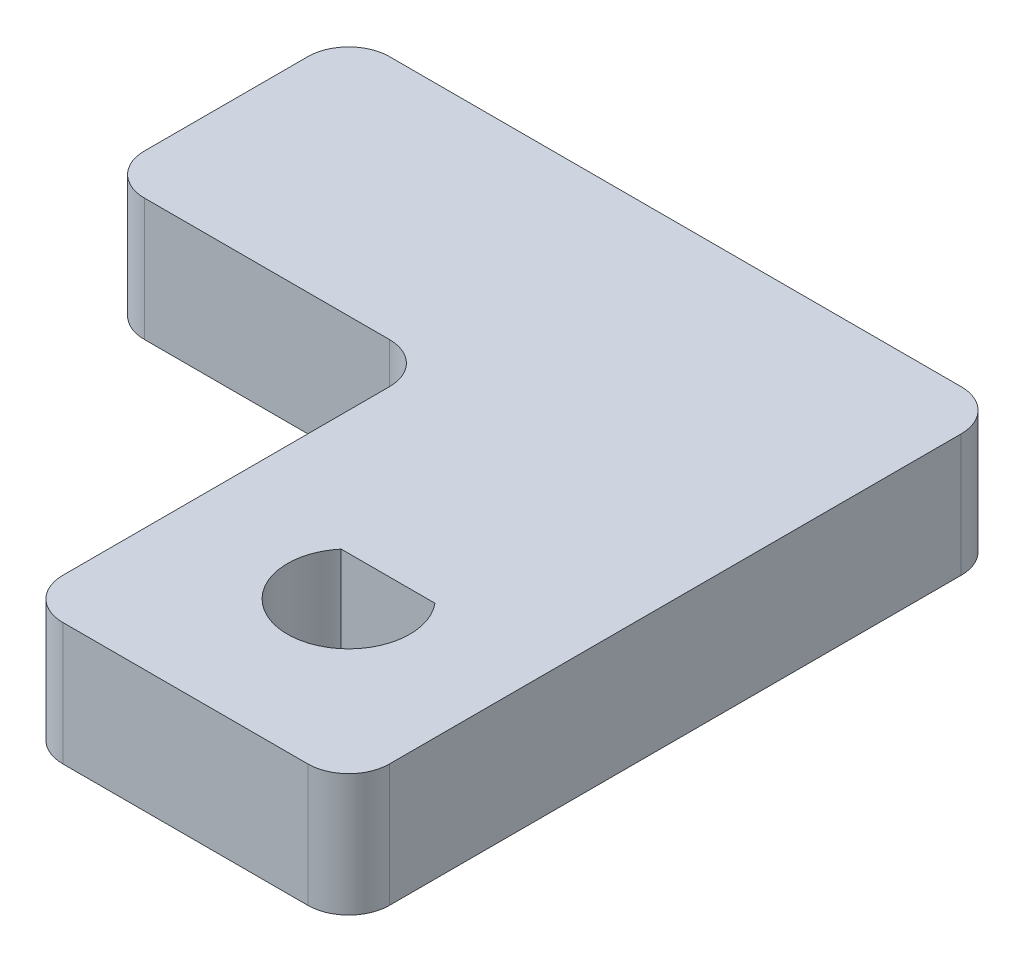
from build123d import *

# Parameters (mm, degrees)
BOSS_EXTRUDE2_DEPTH = 3
FILLET1_R           = 1
FILLET2_R           = 1
FILLET3_R           = 1
FILLET4_R           = 1
FILLET5_R           = 1
FILLET6_R           = 1
CUT_EXTRUDE2_DEPTH  = 3


with BuildPart() as part:
    # Sketch1 → Boss-Extrude2 (new body)
    with BuildSketch(Plane(origin=(0, 0, 0), x_dir=(1, 0, 0), z_dir=(0, 1, 0))):
        Polygon((-6.234693371, -2), (-14.234693371, -2), (-14.234693371, 8), (-22.234693371, 8), (-22.234693371, 14), (-6.234693371, 14), (-6.234693371, 8), align=None)
    extrude(amount=BOSS_EXTRUDE2_DEPTH)

    # Fillet1
    fillet1_edges = [part.edges().sort_by_distance(p)[0] for p in [
        (-22.234693371, 1.5, -14),
    ]]
    fillet(fillet1_edges, radius=FILLET1_R)

    # Fillet2
    fillet2_edges = [part.edges().sort_by_distance(p)[0] for p in [
        (-22.234693371, 1.5, -8),
    ]]
    fillet(fillet2_edges, radius=FILLET2_R)

    # Fillet3
    fillet3_edges = [part.edges().sort_by_distance(p)[0] for p in [
        (-6.234693371, 1.5, -14),
    ]]
    fillet(fillet3_edges, radius=FILLET3_R)

    # Fillet4
    fillet4_edges = [part.edges().sort_by_distance(p)[0] for p in [
        (-14.234693371, 1.5, 2),
    ]]
    fillet(fillet4_edges, radius=FILLET4_R)

    # Fillet5
    fillet5_edges = [part.edges().sort_by_distance(p)[0] for p in [
        (-6.234693371, 1.5, 2),
    ]]
    fillet(fillet5_edges, radius=FILLET5_R)

    # Fillet6
    fillet6_edges = [part.edges().sort_by_distance(p)[0] for p in [
        (-14.234693371, 1.5, -8),
    ]]
    fillet(fillet6_edges, radius=FILLET6_R)

    # Sketch3 → Cut-Extrude2 (cut)
    with BuildSketch(Plane(origin=(0, 3, 0), x_dir=(1, 0, 0), z_dir=(0, 1, 0))):
        with BuildLine():
            Line((-11.383221505, 2.964822846), (-9.086165237, 2.964822846))
            ThreePointArc((-9.086165237, 2.964822846), (-10.234693371, 0.5), (-11.383221505, 2.964822846))
        make_face()
    extrude(amount=-CUT_EXTRUDE2_DEPTH, mode=Mode.SUBTRACT)


solid = part.part
